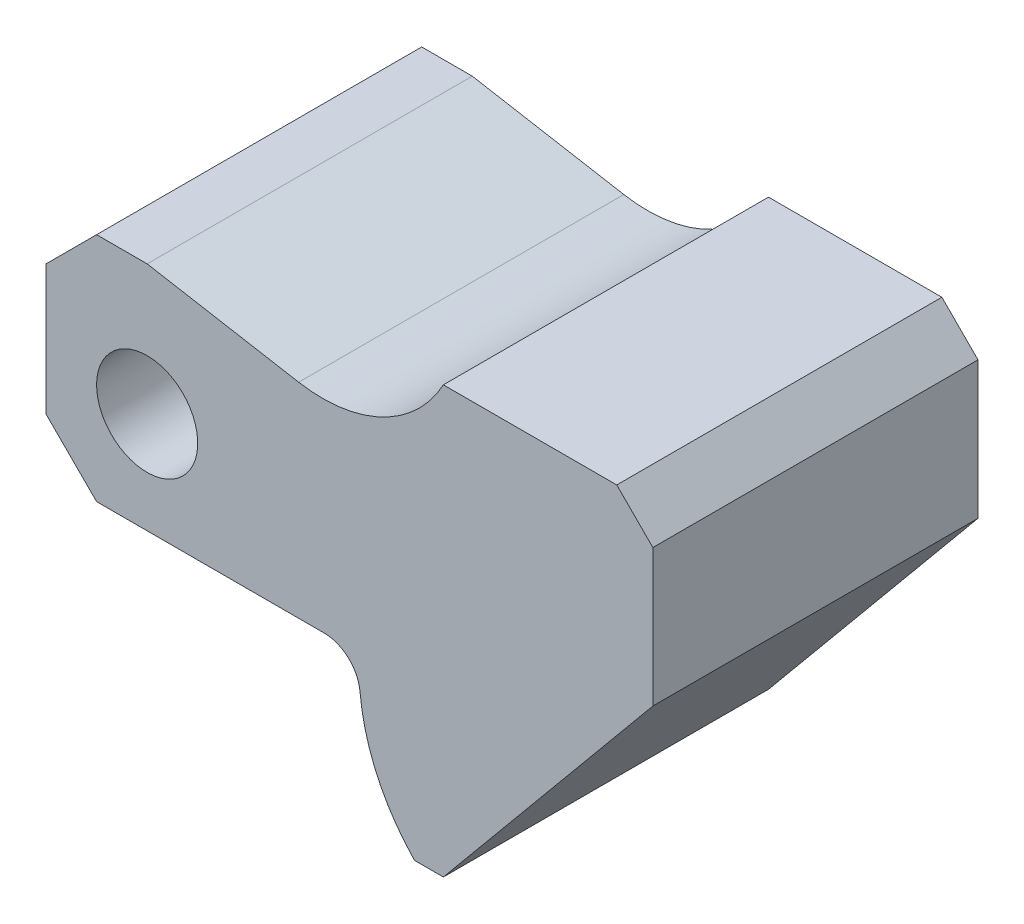
from build123d import *

# Parameters (mm, degrees)
ESQUISSE1_R        = 7
BOSS_EXTRU_2_DEPTH = 45


with BuildPart() as part:
    # Esquisse1 → Boss.-Extru.2 (new body)
    with BuildSketch(Plane.XY):
        with BuildLine():
            Line((33.502581987, 1.407665382), (57.502581987, 1.407665382))
            Line((57.502581987, 1.407665382), (62.502581987, -3.592334618))
            Line((62.502581987, -3.592334618), (62.502581987, -22.592334618))
            Line((62.502581987, -22.592334618), (33.502581987, -57.592334618))
            Line((33.502581987, -57.592334618), (29.502581987, -57.592334618))
            ThreePointArc((29.502581987, -57.592334618), (24.333450387, -50.001682761), (21.96277386, -41.129376977))
            ThreePointArc((21.96277386, -41.129376977), (20.352131518, -37.896743447), (16.984252973, -36.592334618))
            Line((16.984252973, -36.592334618), (-14.497418013, -36.592334618))
            Line((-14.497418013, -36.592334618), (-21.497418013, -29.592334618))
            Line((-21.497418013, -29.592334618), (-21.497418013, -11.592334618))
            Line((-21.497418013, -11.592334618), (-14.497418013, -4.592334618))
            Line((-14.497418013, -4.592334618), (-7.497418013, -4.592334618))
            Line((-7.497418013, -4.592334618), (13.477054889, -8.290700097))
            ThreePointArc((13.477054889, -8.290700097), (25.057973951, -6.679500169), (33.502581987, 1.407665382))
        make_face()
        with Locations(Location((-7.497418013, -22.592334618, 0), (0, 0, 180))):
            Circle(ESQUISSE1_R, mode=Mode.SUBTRACT)
    extrude(amount=BOSS_EXTRU_2_DEPTH)


solid = part.part
